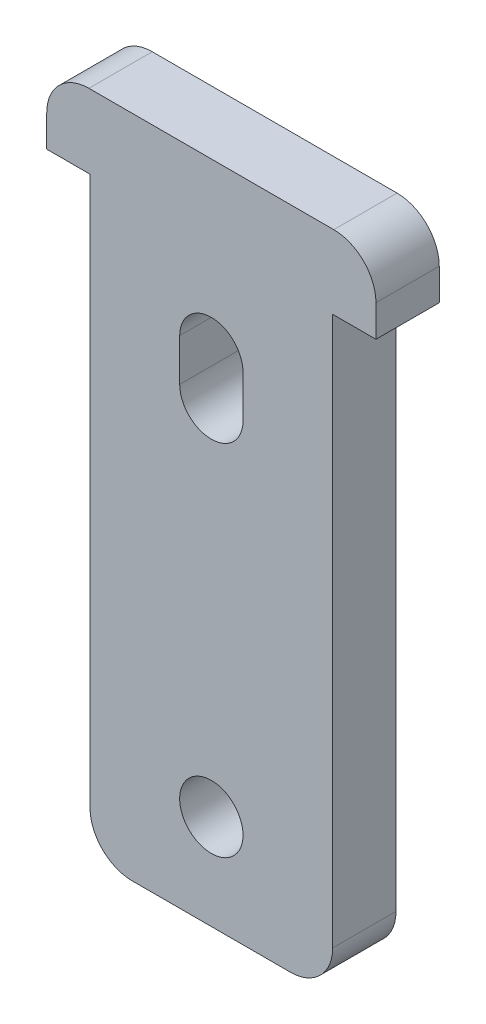
from build123d import *

# Parameters (mm, degrees)
ESBO_O1_R                = 1.5
RESSALTO_EXTRUS_O1_DEPTH = 3
FILETE1_R                = 2
FILETE2_R                = 2


with BuildPart() as part:
    # Esboço1 → Ressalto-extrusão1 (new body)
    with BuildSketch(Plane.XY):
        Polygon((11.5, 28), (13.55, 28), (13.55, 31.5), (-2.05, 31.5), (-2.05, 28), (0, 28), (0, 0), (11.5, 0), align=None)
        with Locations((5.75, 4.5)):
            Circle(ESBO_O1_R, mode=Mode.SUBTRACT)
        with BuildLine():
            Line((4.25, 21.5), (4.25, 23.5))
            ThreePointArc((4.25, 23.5), (5.75, 25), (7.25, 23.5))
            Line((7.25, 23.5), (7.25, 21.5))
            ThreePointArc((7.25, 21.5), (5.75, 20), (4.25, 21.5))
        make_face(mode=Mode.SUBTRACT)
    extrude(amount=RESSALTO_EXTRUS_O1_DEPTH)

    # Filete1
    filete1_edges = [part.edges().sort_by_distance(p)[0] for p in [
        (-2.05, 31.5, 1.5),
        (13.55, 31.5, 1.5),
    ]]
    fillet(filete1_edges, radius=FILETE1_R)

    # Filete2
    filete2_edges = [part.edges().sort_by_distance(p)[0] for p in [
        (11.5, 0, 1.5),
        (0, 0, 1.5),
    ]]
    fillet(filete2_edges, radius=FILETE2_R)


solid = part.part
